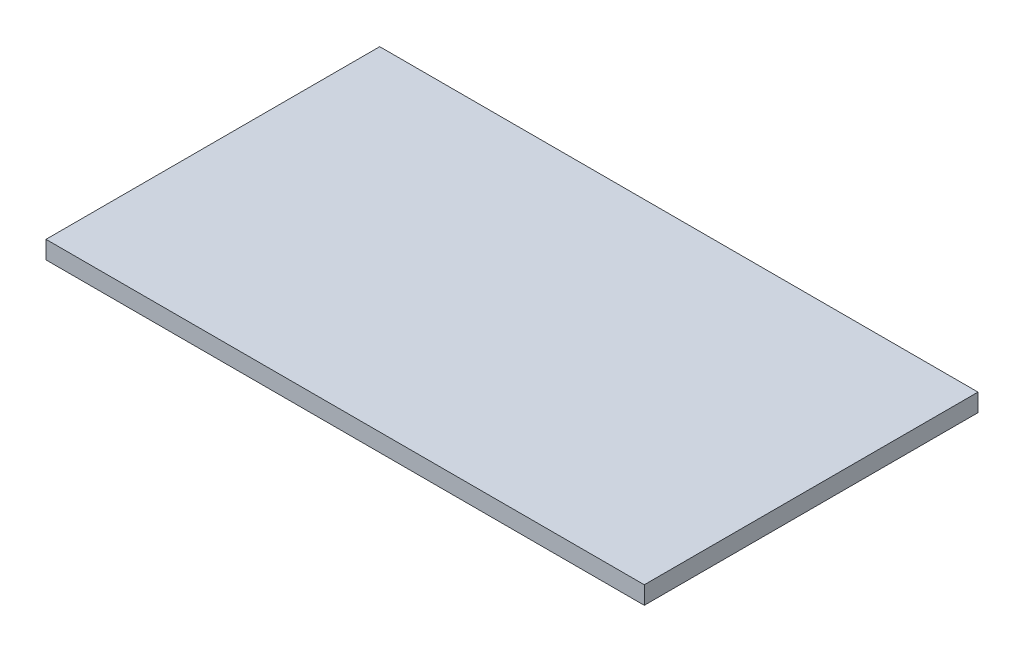
from build123d import *

# Parameters (mm, degrees)
SKETCH1_W           = 1610
SKETCH1_H           = 898
BOSS_EXTRUDE2_DEPTH = 48


with BuildPart() as part:
    # Sketch1 → Boss-Extrude2 (new body)
    with BuildSketch(Plane(origin=(0, 0, 0), x_dir=(1, 0, 0), z_dir=(0, 1, 0))):
        with Locations((805, 449)):
            Rectangle(SKETCH1_W, SKETCH1_H)
    extrude(amount=BOSS_EXTRUDE2_DEPTH)


solid = part.part
